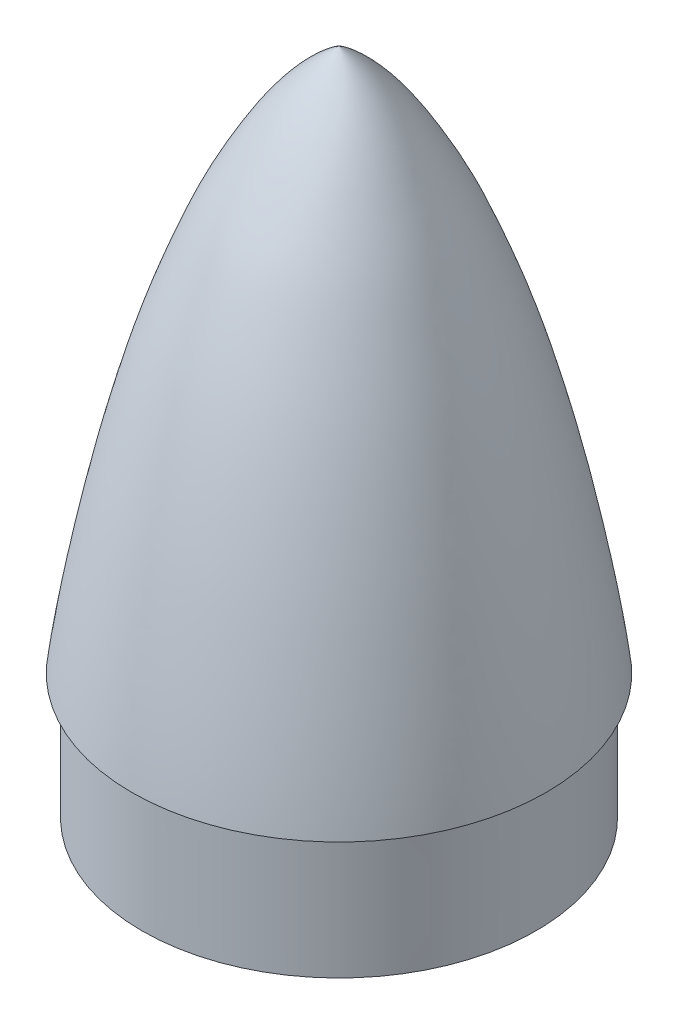
from build123d import *


with BuildPart() as part:
    # Sketch2 → Revolve1 (revolve)
    with BuildSketch(Plane(origin=(0, 0, 0), x_dir=(0, 0, -1), z_dir=(1, 0, 0))):
        with BuildLine():
            Line((-76.834997864, 640), (-76.834997864, 663.739765876))
            Line((-76.834997864, 663.739765876), (-70.484998955, 663.736042569))
            Line((-70.484998955, 663.736042569), (-70.484998955, 665.750915351))
            Line((-70.484998955, 665.750915351), (-79.258423609, 665.750915351))
            add(Edge.make_bspline(
                [(-79.258423609, 665.750915351), (-77.820936389, 673.441033412), (-76.430828609, 684.23409126), (-73.515725058, 697.481376301), (-71.314144633, 706.550597686), (-69.001411997, 715.069986838), (-66.088762599, 724.325296016), (-62.956729918, 732.706904648), (-59.583630489, 740.966851543), (-53.480371306, 752.610789375), (-47.722539683, 761.30632688), (-41.274997711, 766)],
                knots=[0.018392631, 0.018392631, 0.018392631, 0.018392631, 0.229345084, 0.311367758, 0.383988251, 0.480976641, 0.549325679, 0.645508395, 0.722205603, 0.789606484, 1, 1, 1, 1], degree=3))
            Line((-41.274997711, 766), (-41.274997711, 767))
            add(Edge.make_bspline(
                [(-80.644990943, 663.741999857), (-79.549515028, 672.274081847), (-77.470530473, 683.715125998), (-74.499073842, 697.722929967), (-71.673376757, 709.269064542), (-68.298060234, 721.269154814), (-63.880137387, 733.092990878), (-60.483289367, 741.405259678), (-54.208721386, 753.370793333), (-48.242431496, 762.365061791), (-41.274997711, 767)],
                knots=[0, 0, 0, 0, 0.228759559, 0.309272632, 0.380932337, 0.54503245, 0.640457782, 0.716706438, 0.783654625, 1, 1, 1, 1], degree=3))
            Line((-80.644990943, 663.741999857), (-78.735167737, 663.740880036))
            Line((-78.735167737, 663.740880036), (-78.739997864, 640))
            Line((-78.739997864, 640), (-76.834997864, 640))
        make_face()
    revolve(axis=Axis((0, 663.718915351, 41.274997711), (0, 1, 0)))


solid = part.part
